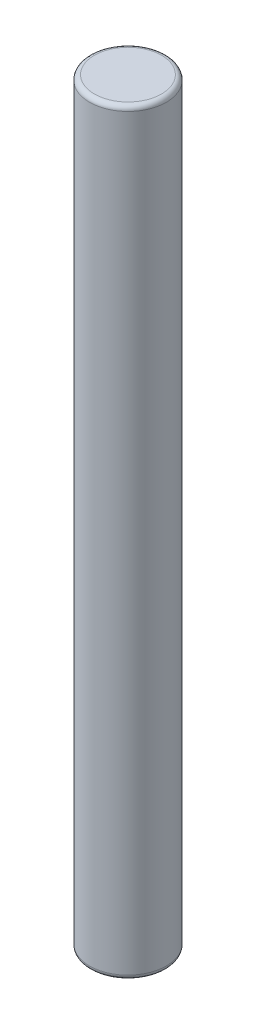
from build123d import *

# Parameters (mm, degrees)
SKETCH1_R           = 2
BOSS_EXTRUDE1_DEPTH = 39.5
FILLET1_R           = 0.25


with BuildPart() as part:
    # Sketch1 → Boss-Extrude1 (new body)
    with BuildSketch(Plane(origin=(0, 0, 0), x_dir=(1, 0, 0), z_dir=(0, 1, 0))):
        with Locations(Location((0, 0, 0), (0, 0, 270))):
            Circle(SKETCH1_R)
    extrude(amount=BOSS_EXTRUDE1_DEPTH)

    # Fillet1
    fillet1_edges = [part.edges().sort_by_distance(p)[0] for p in [
        (0, 0, -2),
        (0, 39.5, -2),
    ]]
    fillet(fillet1_edges, radius=FILLET1_R)


solid = part.part
